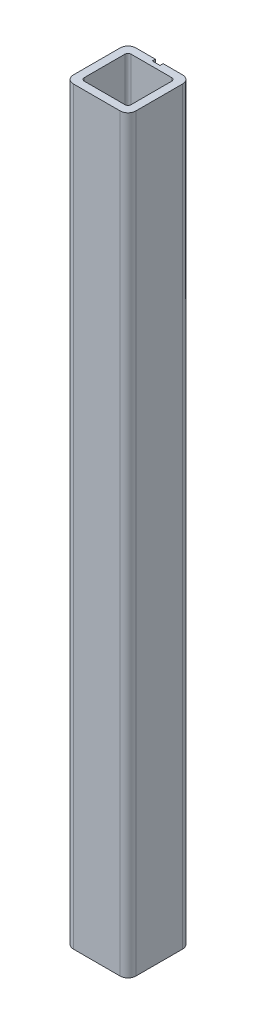
from build123d import *

# Parameters (mm, degrees)
SKETCH1_W           = 50.8
SKETCH1_H           = 50.8
BOSS_EXTRUDE1_DEPTH = 558.8
SKETCH3_W           = 50.8
SKETCH3_H           = 50.8
BOSS_EXTRUDE2_DEPTH = 50.8
FILLET2_R           = 6.35
SKETCH4_W           = 6.35
SKETCH4_H           = 609.6
CUT_EXTRUDE2_DEPTH  = 2.54
CUT_EXTRUDE3_DEPTH  = 614.818735459


with BuildPart() as part:
    # Sketch1 → Boss-Extrude1 (new body)
    with BuildSketch(Plane(origin=(0, 0, 0), x_dir=(1, 0, 0), z_dir=(0, 1, 0))):
        with Locations((25.4, 25.4)):
            Rectangle(SKETCH1_W, SKETCH1_H)
    extrude(amount=BOSS_EXTRUDE1_DEPTH)

    # Sketch3 → Boss-Extrude2 (add)
    with BuildSketch(Plane.XZ):
        with Locations((25.4, -25.4)):
            Rectangle(SKETCH3_W, SKETCH3_H)
    extrude(amount=BOSS_EXTRUDE2_DEPTH)

    # Fillet2
    fillet2_edges = [part.edges().sort_by_distance(p)[0] for p in [
        (0, 254, -50.8),
        (50.8, 254, -50.8),
        (50.8, 254, 0),
        (0, 254, 0),
    ]]
    fillet(fillet2_edges, radius=FILLET2_R)

    # Sketch4 → Cut-Extrude2 (cut)
    with BuildSketch(Plane(origin=(0, 0, -50.8), x_dir=(-1, 0, 0), z_dir=(0, 0, -1))):
        with Locations((-25.4, 254)):
            Rectangle(SKETCH4_W, SKETCH4_H)
    extrude(amount=-CUT_EXTRUDE2_DEPTH, mode=Mode.SUBTRACT)

    # Sketch5 → Cut-Extrude3 (cut, through all)
    with BuildSketch(Plane(origin=(0, 558.8, 0), x_dir=(1, 0, 0), z_dir=(0, 1, 0))):
        with BuildLine():
            Line((34.925, 44.45), (15.875, 44.45))
            Line((15.875, 44.45), (8.89, 44.45))
            ThreePointArc((8.89, 44.45), (7.093948776, 43.706051224), (6.35, 41.91))
            Line((6.35, 41.91), (6.35, 8.89))
            ThreePointArc((6.35, 8.89), (7.093948776, 7.093948776), (8.89, 6.35))
            Line((8.89, 6.35), (41.91, 6.35))
            ThreePointArc((41.91, 6.35), (43.706051224, 7.093948776), (44.45, 8.89))
            Line((44.45, 8.89), (44.45, 41.91))
            ThreePointArc((44.45, 41.91), (43.706051224, 43.706051224), (41.91, 44.45))
            Line((41.91, 44.45), (34.925, 44.45))
        make_face()
    extrude(amount=-CUT_EXTRUDE3_DEPTH, mode=Mode.SUBTRACT)


solid = part.part
